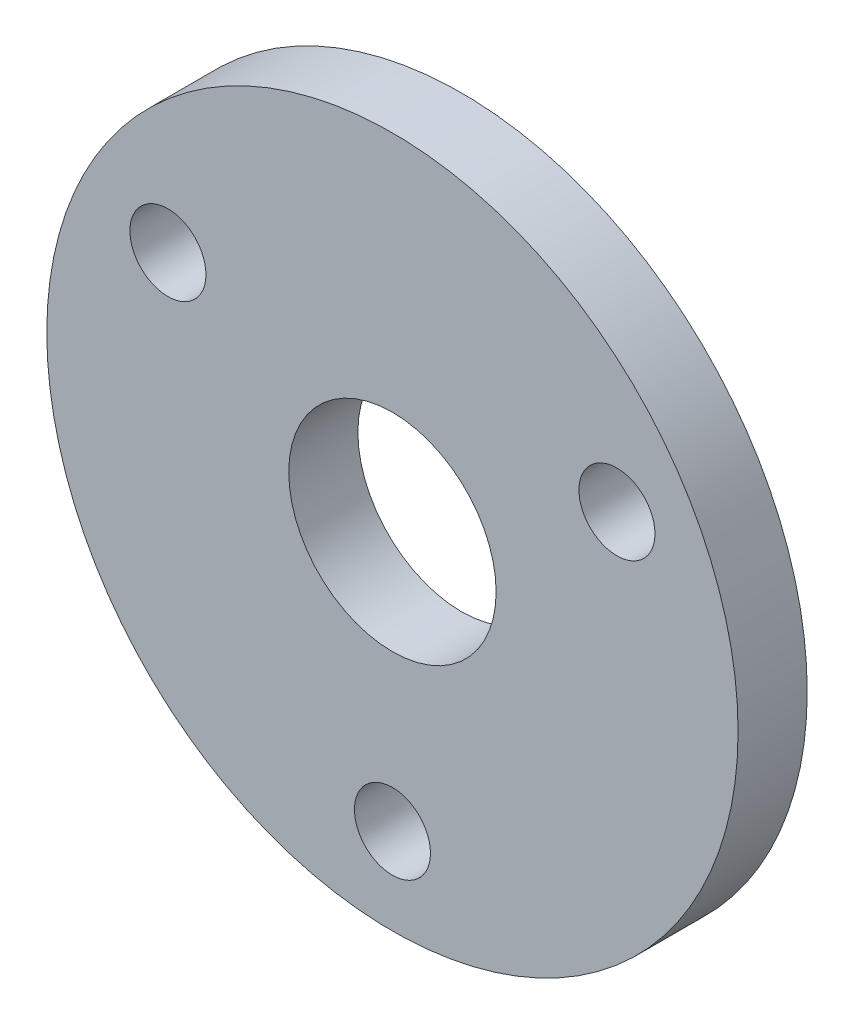
from build123d import *

# Parameters (mm, degrees)
SKETCH_1_R      = 10
SKETCH_1_R_2    = 3
SKETCH_1_R_3    = 1.1
EXTRUDE_1_DEPTH = 2


with BuildPart() as part:
    # 草图1 → 凸台-拉伸1 (new body)
    with BuildSketch(Plane.XY):
        Circle(SKETCH_1_R)
        Circle(SKETCH_1_R_2, mode=Mode.SUBTRACT)
        with Locations((0, -7.5)):
            Circle(SKETCH_1_R_3, mode=Mode.SUBTRACT)
        with Locations((-6.495190528, 3.75)):
            Circle(SKETCH_1_R_3, mode=Mode.SUBTRACT)
        with Locations((6.495190528, 3.75)):
            Circle(SKETCH_1_R_3, mode=Mode.SUBTRACT)
    extrude(amount=EXTRUDE_1_DEPTH)


solid = part.part
